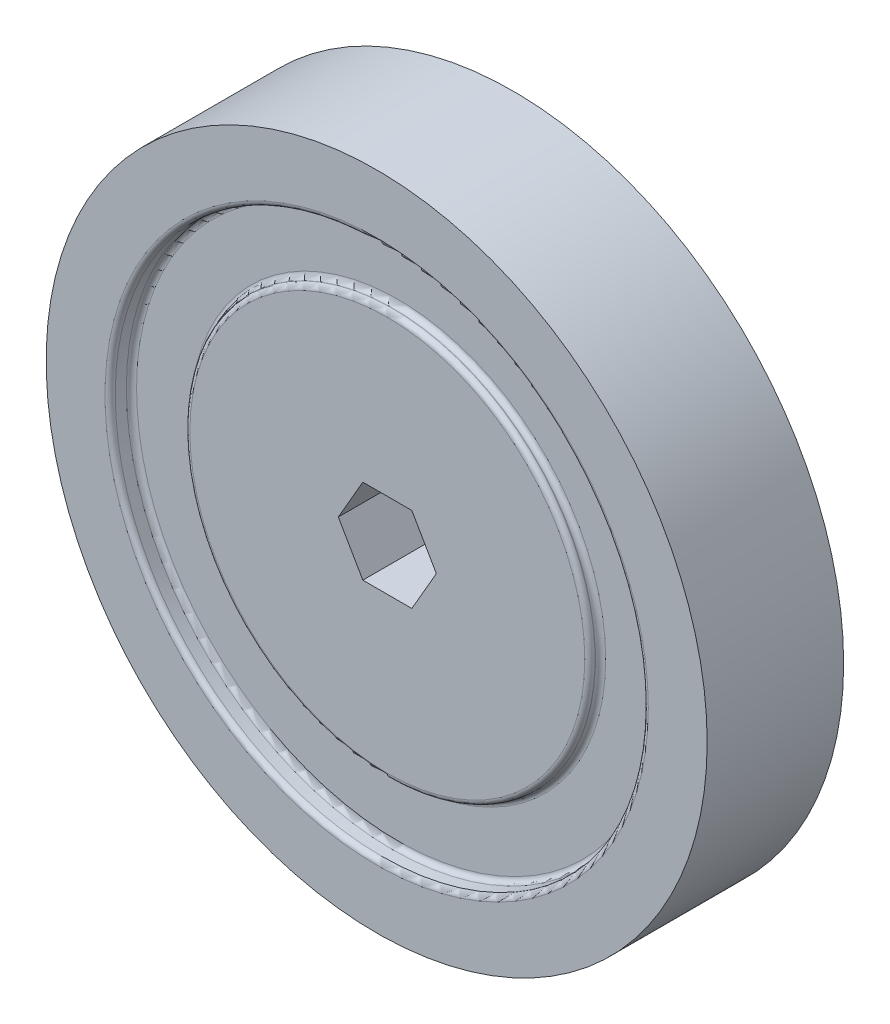
from build123d import *

# Parameters (mm, degrees)
BOSS_EXTRUDE1_DEPTH      = 10.16
BOSS_EXTRUDE1_DEPTH_BACK = 10.16
SKETCH1_R                = 49.2125
CUT_EXTRUDE1_DEPTH       = 73.502708311
FILLET1_R                = 0.762
FILLET2_R                = 0.762


with BuildPart() as part:
    # Sketch1 → Boss-Extrude1 (new, two sides: drawn at the far end of the back side and taken through both)
    with BuildSketch(Plane.XY.offset(-BOSS_EXTRUDE1_DEPTH_BACK)):
        Circle(SKETCH1_R)
    extrude(amount=BOSS_EXTRUDE1_DEPTH + BOSS_EXTRUDE1_DEPTH_BACK)

    # Sketch2 → Cut-Extrude1 (cut, through all)
    with BuildSketch(Plane.XY.offset(10.16)):
        Polygon((3.648853701, 6.32), (-3.648853701, 6.32), (-7.297707403, 0), (-3.648853701, -6.32), (3.648853701, -6.32), (7.297707403, 0), align=None)
    extrude(amount=-CUT_EXTRUDE1_DEPTH, mode=Mode.SUBTRACT)

    # Sketch3 → Cut-Revolve1 (revolve, cut)
    with BuildSketch(Plane(origin=(0, 0, 0), x_dir=(0, 0, -1), z_dir=(1, 0, 0))):
        Polygon((8.5725, 30.1625), (6.985, 30.1625), (6.985, 39.6875), (10.16, 39.6875), (10.16, 0), (8.5725, 0), align=None)
    cut_revolve1 = revolve(axis=Axis((0, 0, -22.753035396), (0, 0, 1)), mode=Mode.SUBTRACT)

    # Fillet1
    fillet1_edges = [part.edges().sort_by_distance(p)[0] for p in [
        (0, -30.1625, -6.985),
        (0, -39.6875, -10.16),
        (0, -30.1625, -8.5725),
    ]]
    fillet(fillet1_edges, radius=FILLET1_R)

    # Mirror1: Cut-Revolve1 across plane
    add(cut_revolve1.mirror(Plane.XY), mode=Mode.SUBTRACT)

    # Fillet2
    fillet2_edges = [part.edges().sort_by_distance(p)[0] for p in [
        (0, -39.6875, 10.16),
        (0, -39.6875, 6.985),
        (0, -30.1625, 6.985),
        (0, -30.1625, 8.5725),
    ]]
    fillet(fillet2_edges, radius=FILLET2_R)


solid = part.part
